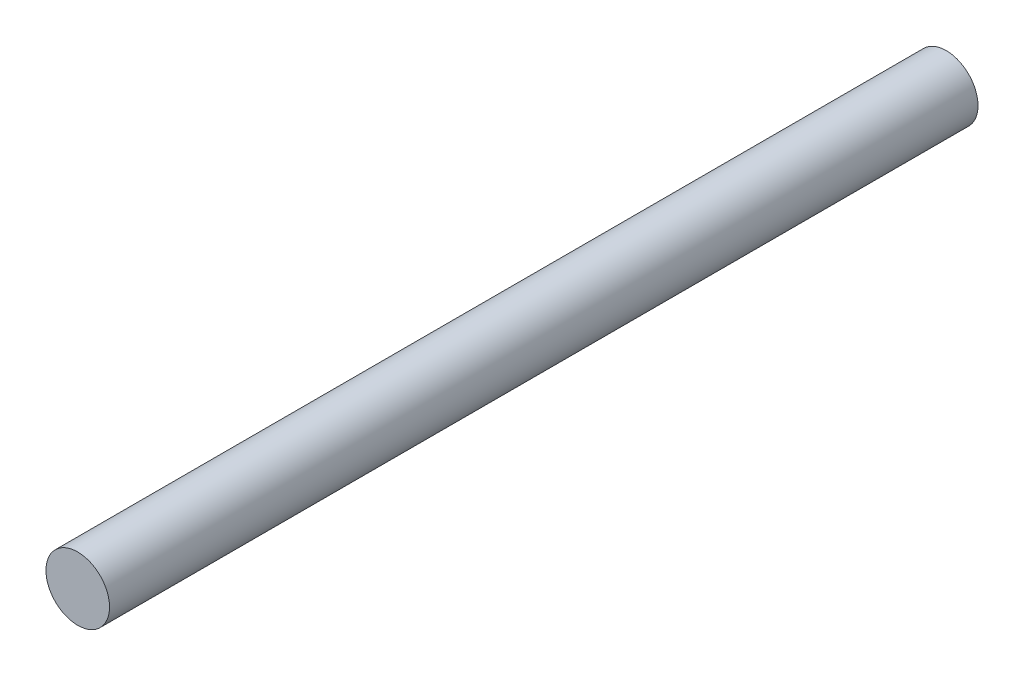
from build123d import *

# Parameters (mm, degrees)
SKETCH1_R           = 1.94
BOSS_EXTRUDE1_DEPTH = 53


with BuildPart() as part:
    # Sketch1 → Boss-Extrude1 (new body)
    with BuildSketch(Plane.XY):
        Circle(SKETCH1_R)
    extrude(amount=BOSS_EXTRUDE1_DEPTH)


solid = part.part
